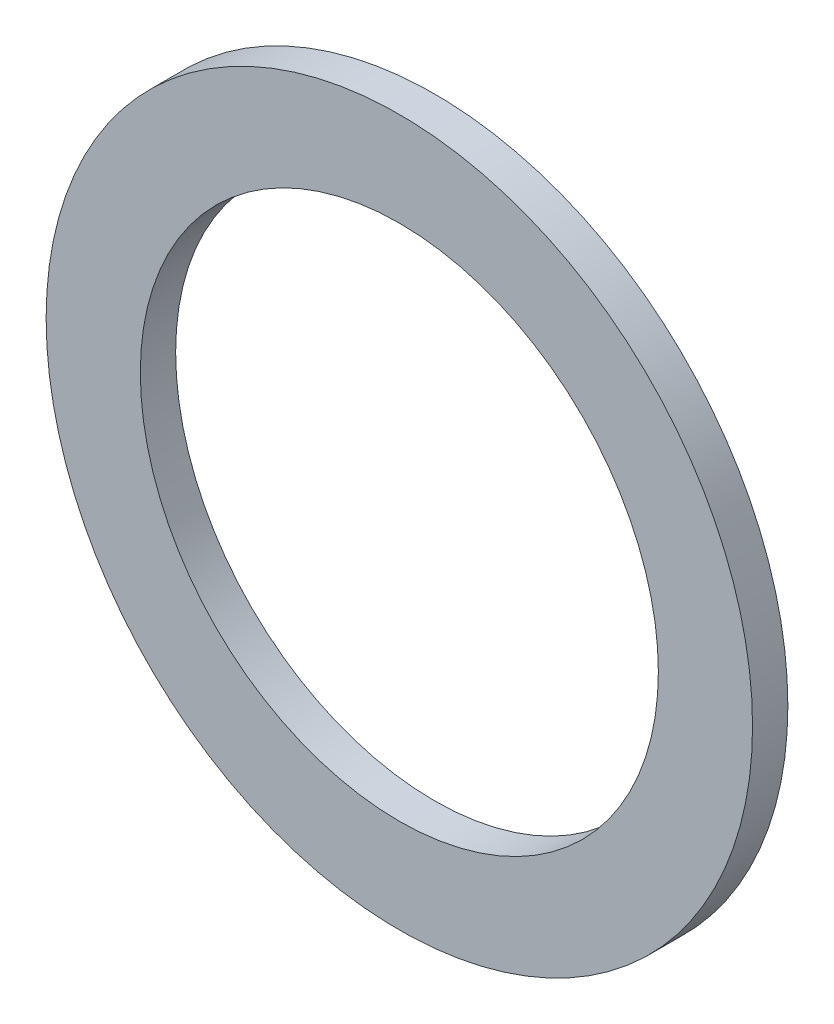
from build123d import *

# Parameters (mm, degrees)
SKETCH1_R           = 15
SKETCH1_R_2         = 11
BOSS_EXTRUDE1_DEPTH = 1.5


with BuildPart() as part:
    # Sketch1 → Boss-Extrude1 (new body)
    with BuildSketch(Plane.XY):
        Circle(SKETCH1_R)
        Circle(SKETCH1_R_2, mode=Mode.SUBTRACT)
    extrude(amount=BOSS_EXTRUDE1_DEPTH)


solid = part.part
